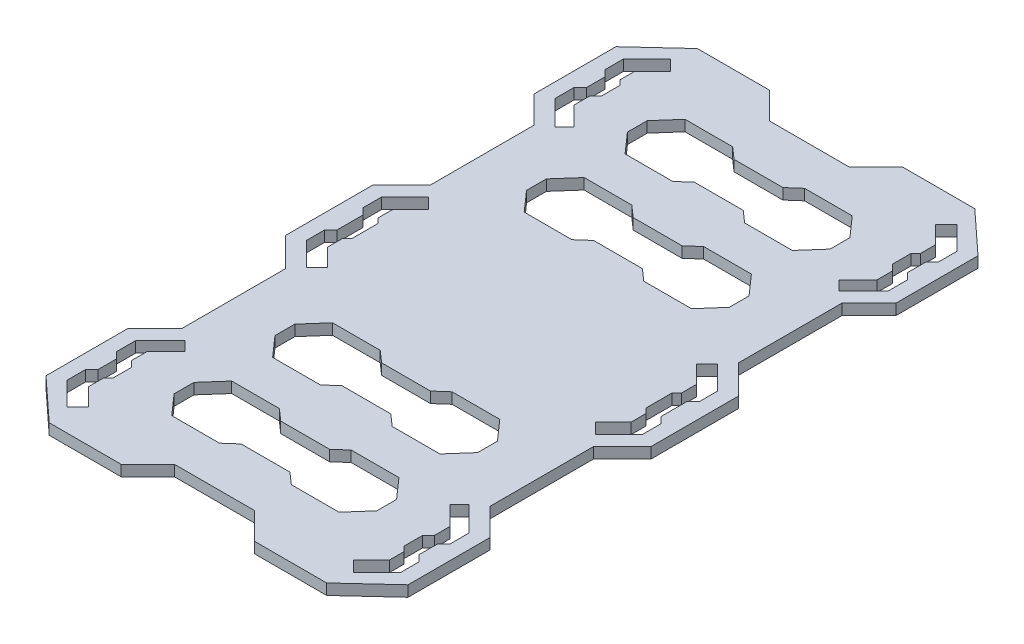
from build123d import *

# Parameters (mm, degrees)
CUT_EXTRUDE1_DEPTH   = 69.647588517
CUT_EXTRUDE2_DEPTH   = 69.647588517
CUT_EXTRUDE3_DEPTH   = 69.647588517
MIRROR2_COPY_1_DEPTH = 69.647588517
MIRROR5_COPY_1_DEPTH = 69.647588517
MIRROR6_COPY_1_DEPTH = 69.647588517


with BuildPart() as part:
    # Sketch6 → Loft1 section 0
    with BuildSketch(Plane(origin=(0, 2, 0), x_dir=(1, 0, 0), z_dir=(0, 1, 0))):
        with BuildLine():
            Line((7.396713812, 54.851445313), (-7.396713812, 54.851445313))
            Line((-7.396713812, 54.851445313), (-12.312739353, 59.767470855))
            Line((-12.312739353, 59.767470855), (-25.583898433, 59.767470855))
            Line((-25.583898433, 59.767470855), (-33.387669429, 52.552867742))
            Line((-33.387669429, 52.552867742), (-33.387669429, 37.418201589))
            Line((-33.387669429, 37.418201589), (-28.405320654, 32.435852813))
            Line((-28.405320654, 32.435852813), (-28.405320654, 13.396729515))
            Line((-28.405320654, 13.396729515), (-33.709654667, 8.092395502))
            Line((-33.709654667, 8.092395502), (-33.709654667, 0))
            Line((-33.709654667, 0), (-33.709654667, -8.092395502))
            Line((-33.709654667, -8.092395502), (-28.405320654, -13.396729515))
            Line((-28.405320654, -13.396729515), (-28.405320654, -32.435852813))
            Line((-28.405320654, -32.435852813), (-33.387669429, -37.418201589))
            Line((-33.387669429, -37.418201589), (-33.387669429, -52.552867742))
            Line((-33.387669429, -52.552867742), (-25.583898433, -59.767470855))
            Line((-25.583898433, -59.767470855), (-12.312739353, -59.767470855))
            Line((-12.312739353, -59.767470855), (-7.396713812, -54.851445313))
            Line((-7.396713812, -54.851445313), (7.396713812, -54.851445313))
            Line((7.396713812, -54.851445313), (12.312739353, -59.767470855))
            Line((12.312739353, -59.767470855), (25.583898433, -59.767470855))
            Line((25.583898433, -59.767470855), (33.387669429, -52.552867742))
            Line((33.387669429, -52.552867742), (33.387669429, -37.418201589))
            Line((33.387669429, -37.418201589), (28.405320654, -32.435852813))
            Line((28.405320654, -32.435852813), (28.405320654, -13.396729515))
            Line((28.405320654, -13.396729515), (33.709654667, -8.092395502))
            Line((33.709654667, -8.092395502), (33.709654667, 0))
            Line((33.709654667, 0), (33.709654667, 8.092395502))
            Line((33.709654667, 8.092395502), (28.405320654, 13.396729515))
            Line((28.405320654, 13.396729515), (28.405320654, 32.435852813))
            Line((28.405320654, 32.435852813), (33.387669429, 37.418201589))
            Line((33.387669429, 37.418201589), (33.387669429, 52.552867742))
            Line((33.387669429, 52.552867742), (25.583898433, 59.767470855))
            Line((25.583898433, 59.767470855), (12.312739353, 59.767470855))
            Line((12.312739353, 59.767470855), (7.396713812, 54.851445313))
        make_face()
    # Sketch2 → Loft1 section 1
    with BuildSketch(Plane(origin=(0, 0, 0), x_dir=(1, 0, 0), z_dir=(0, 1, 0))):
        with BuildLine():
            Line((7.396713812, 54.851445313), (-7.396713812, 54.851445313))
            Line((-7.396713812, 54.851445313), (-12.312739353, 59.767470855))
            Line((-12.312739353, 59.767470855), (-25.583898433, 59.767470855))
            Line((-25.583898433, 59.767470855), (-33.387669429, 52.552867742))
            Line((-33.387669429, 52.552867742), (-33.387669429, 37.418201589))
            Line((-33.387669429, 37.418201589), (-28.405320654, 32.435852813))
            Line((-28.405320654, 32.435852813), (-28.405320654, 13.396729515))
            Line((-28.405320654, 13.396729515), (-33.709654667, 8.092395502))
            Line((-33.709654667, 8.092395502), (-33.709654667, 0))
            Line((-33.709654667, 0), (-33.709654667, -8.092395502))
            Line((-33.709654667, -8.092395502), (-28.405320654, -13.396729515))
            Line((-28.405320654, -13.396729515), (-28.405320654, -32.435852813))
            Line((-28.405320654, -32.435852813), (-33.387669429, -37.418201589))
            Line((-33.387669429, -37.418201589), (-33.387669429, -52.552867742))
            Line((-33.387669429, -52.552867742), (-25.583898433, -59.767470855))
            Line((-25.583898433, -59.767470855), (-12.312739353, -59.767470855))
            Line((-12.312739353, -59.767470855), (-7.396713812, -54.851445313))
            Line((-7.396713812, -54.851445313), (7.396713812, -54.851445313))
            Line((7.396713812, -54.851445313), (12.312739353, -59.767470855))
            Line((12.312739353, -59.767470855), (25.583898433, -59.767470855))
            Line((25.583898433, -59.767470855), (33.387669429, -52.552867742))
            Line((33.387669429, -52.552867742), (33.387669429, -37.418201589))
            Line((33.387669429, -37.418201589), (28.405320654, -32.435852813))
            Line((28.405320654, -32.435852813), (28.405320654, -13.396729515))
            Line((28.405320654, -13.396729515), (33.709654667, -8.092395502))
            Line((33.709654667, -8.092395502), (33.709654667, 0))
            Line((33.709654667, 0), (33.709654667, 8.092395502))
            Line((33.709654667, 8.092395502), (28.405320654, 13.396729515))
            Line((28.405320654, 13.396729515), (28.405320654, 32.435852813))
            Line((28.405320654, 32.435852813), (33.387669429, 37.418201589))
            Line((33.387669429, 37.418201589), (33.387669429, 52.552867742))
            Line((33.387669429, 52.552867742), (25.583898433, 59.767470855))
            Line((25.583898433, 59.767470855), (12.312739353, 59.767470855))
            Line((12.312739353, 59.767470855), (7.396713812, 54.851445313))
        make_face()
    loft()

    # Sketch3 → Cut-Extrude1 (cut, symmetric)
    with BuildSketch(Plane(origin=(0, 0, 0), x_dir=(1, 0, 0), z_dir=(0, 1, 0))):
        Polygon((-26.412409321, 55.611507487), (-24.434458611, 53.633556777), (-27.717448964, 50.350566425), (-27.717448964, 47.618139671), (-26.840625454, 46.741316161), (-26.840625454, 43.335978341), (-27.931557031, 42.245046764), (-27.931557031, 39.380076922), (-24.434458611, 35.882978503), (-26.183007821, 34.134429293), (-30.735353139, 38.686774612), (-30.735353139, 42.183873031), (-29.583247829, 43.335978341), (-29.583247829, 46.741316161), (-30.735353139, 47.893421471), (-30.735353139, 51.288563668), align=None)
    cut_extrude1 = extrude(amount=CUT_EXTRUDE1_DEPTH, both=True, mode=Mode.SUBTRACT)

    # Sketch4 → Cut-Extrude2 (cut, symmetric)
    with BuildSketch(Plane(origin=(0, 0, 0), x_dir=(1, 0, 0), z_dir=(0, 1, 0))):
        Polygon((-26.664718541, 11.271168439), (-24.686767832, 9.293217729), (-27.969758185, 6.010227376), (-27.969758185, 3.277800623), (-27.092934674, 2.400977113), (-27.092934674, 0), (-29.83555705, 0), (-29.83555705, 2.400977113), (-30.98766236, 3.553082423), (-30.98766236, 6.94822462), align=None)
    cut_extrude2 = extrude(amount=CUT_EXTRUDE2_DEPTH, both=True, mode=Mode.SUBTRACT)

    # Sketch5 → Cut-Extrude3 (cut, symmetric)
    with BuildSketch(Plane(origin=(0, 0, 0), x_dir=(1, 0, 0), z_dir=(0, 1, 0))):
        Polygon((-18.6893734, 39.974330934), (-18.6893734, 43.627053871), (-15.421147614, 47.327838951), (-6.625775279, 47.327838951), (-4.503266189, 45.453415339), (4.503266189, 45.453415339), (6.625775279, 47.327838951), (15.421147614, 47.327838951), (18.6893734, 43.627053871), (18.6893734, 39.974330934), (15.421147614, 36.273545853), (6.625775279, 36.273545853), (4.503266189, 38.147969465), (-4.503266189, 38.147969465), (-6.625775279, 36.273545853), (-15.421147614, 36.273545853), align=None)
    cut_extrude3 = extrude(amount=CUT_EXTRUDE3_DEPTH, both=True, mode=Mode.SUBTRACT)

    # Mirror1: Cut-Extrude3 across plane
    add(cut_extrude3.mirror(Plane.XY.offset(-32.5)), mode=Mode.SUBTRACT)

    # Mirror2: Cut-Extrude3 across plane
    add(cut_extrude3.mirror(Plane.XY), mode=Mode.SUBTRACT)

    # Mirror2 copy 1 sketch → Mirror2 copy 1 (cut, symmetric)
    with BuildSketch(Plane(origin=(0, 0, 65), x_dir=(1, 0, 0), z_dir=(0, 1, 0))):
        Polygon((-18.6893734, 39.974330934), (-18.6893734, 43.627053871), (-15.421147614, 47.327838951), (-6.625775279, 47.327838951), (-4.503266189, 45.453415339), (4.503266189, 45.453415339), (6.625775279, 47.327838951), (15.421147614, 47.327838951), (18.6893734, 43.627053871), (18.6893734, 39.974330934), (15.421147614, 36.273545853), (6.625775279, 36.273545853), (4.503266189, 38.147969465), (-4.503266189, 38.147969465), (-6.625775279, 36.273545853), (-15.421147614, 36.273545853), align=None)
    extrude(amount=MIRROR2_COPY_1_DEPTH, both=True, mode=Mode.SUBTRACT)

    # Mirror3: Cut-Extrude1 across plane
    add(cut_extrude1.mirror(Plane(origin=(0, 0, 0), x_dir=(0, 0, 1), z_dir=(1, 0, 0))), mode=Mode.SUBTRACT)

    # Mirror4: Cut-Extrude2 across plane
    add(cut_extrude2.mirror(Plane.XY), mode=Mode.SUBTRACT)

    # Mirror5: Cut-Extrude1 across plane
    add(cut_extrude1.mirror(Plane.XY), mode=Mode.SUBTRACT)

    # Mirror5 copy 1 sketch → Mirror5 copy 1 (cut, symmetric)
    with BuildSketch(Plane(origin=(0, 0, 0), x_dir=(-1, 0, 0), z_dir=(0, 1, 0))):
        Polygon((-26.412409321, 55.611507487), (-24.434458611, 53.633556777), (-27.717448964, 50.350566425), (-27.717448964, 47.618139671), (-26.840625454, 46.741316161), (-26.840625454, 43.335978341), (-27.931557031, 42.245046764), (-27.931557031, 39.380076922), (-24.434458611, 35.882978503), (-26.183007821, 34.134429293), (-30.735353139, 38.686774612), (-30.735353139, 42.183873031), (-29.583247829, 43.335978341), (-29.583247829, 46.741316161), (-30.735353139, 47.893421471), (-30.735353139, 51.288563668), align=None)
    extrude(amount=MIRROR5_COPY_1_DEPTH, both=True, mode=Mode.SUBTRACT)

    # Mirror6: Cut-Extrude2 across plane
    add(cut_extrude2.mirror(Plane(origin=(0, 0, 0), x_dir=(0, 0, 1), z_dir=(1, 0, 0))), mode=Mode.SUBTRACT)

    # Mirror6 copy 1 sketch → Mirror6 copy 1 (cut, symmetric)
    with BuildSketch(Plane(origin=(0, 0, 0), x_dir=(-1, 0, 0), z_dir=(0, 1, 0))):
        Polygon((-26.664718541, 11.271168439), (-24.686767832, 9.293217729), (-27.969758185, 6.010227376), (-27.969758185, 3.277800623), (-27.092934674, 2.400977113), (-27.092934674, 0), (-29.83555705, 0), (-29.83555705, 2.400977113), (-30.98766236, 3.553082423), (-30.98766236, 6.94822462), align=None)
    extrude(amount=MIRROR6_COPY_1_DEPTH, both=True, mode=Mode.SUBTRACT)


solid = part.part
